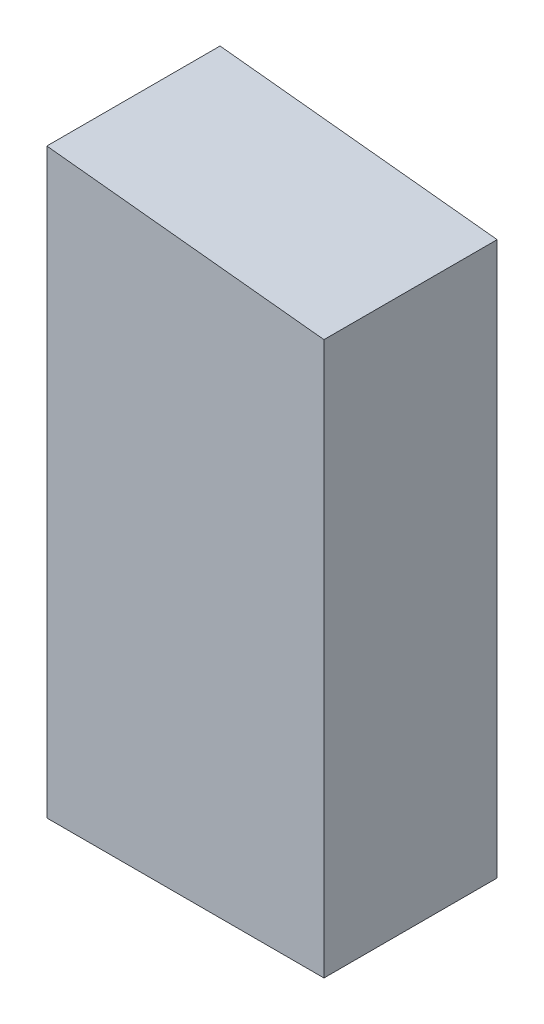
from build123d import *

# Parameters (mm, degrees)
ESQUISSE1_W                  = 40
ESQUISSE1_H                  = 84
BOSS_EXTRU_1_DEPTH           = 25
ENL_V_MAT_EXTRU_1_DEPTH      = 97.337946833
ENL_V_MAT_EXTRU_1_DEPTH_BACK = 97.337946833


with BuildPart() as part:
    # Esquisse1 → Boss.-Extru.1 (new body)
    with BuildSketch(Plane.XY):
        with Locations((20, 42)):
            Rectangle(ESQUISSE1_W, ESQUISSE1_H)
    extrude(amount=BOSS_EXTRU_1_DEPTH)

    # Esquisse2 → Enlèv. mat.-Extru.1 (cut, two sides: drawn at the far end of the back side and taken through both)
    with BuildSketch(Plane.XY.offset(25).offset(-ENL_V_MAT_EXTRU_1_DEPTH_BACK)):
        Polygon((40, 79.795830589), (0, 84), (40, 84), align=None)
    extrude(amount=ENL_V_MAT_EXTRU_1_DEPTH + ENL_V_MAT_EXTRU_1_DEPTH_BACK, mode=Mode.SUBTRACT)


solid = part.part
